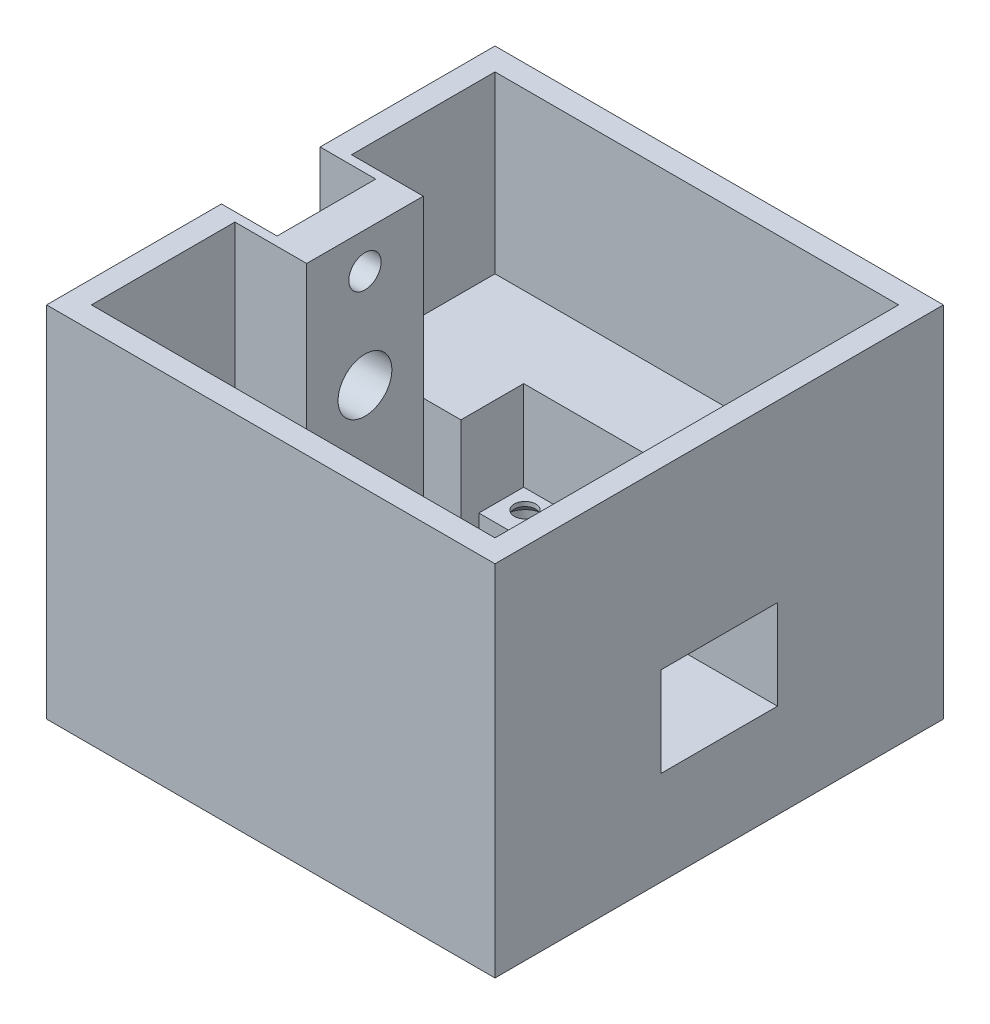
from build123d import *

# Parameters (mm, degrees)
SKETCH1_W                                      = 50
SKETCH1_H                                      = 50
BOSS_EXTRUDE1_DEPTH                            = 40
SHELL1_T                                       = -2.5
BOSS_EXTRUDE5_DEPTH                            = 18
SKETCH17_W                                     = 22.5
SKETCH17_H                                     = 6.5
BOSS_EXTRUDE6_DEPTH                            = 8
SKETCH18_W                                     = 6.5
SKETCH18_H                                     = 29.5
BOSS_EXTRUDE7_DEPTH                            = 8
SKETCH19_W                                     = 11
SKETCH19_H                                     = 30.2
CUT_EXTRUDE5_DEPTH                             = 6.2
SKETCH20_W                                     = 30.2
SKETCH20_H                                     = 5.4
CUT_EXTRUDE6_DEPTH                             = 6.2
SKETCH21_W                                     = 5
SKETCH21_H                                     = 5
BOSS_EXTRUDE8_DEPTH                            = 8
CSK_SLOT_FOR_M1_6_COUNTERSUNK_FLAT_H_2_COUNT   = 2
CSK_SLOT_FOR_M1_6_COUNTERSUNK_FLAT_H_2_PITCH   = 22
SKETCH28_R                                     = 3
CUT_EXTRUDE7_DEPTH                             = 47.046172479
CSK_SLOT_FOR_M1_6_COUNTERSUNK_FLAT_H_3_A_COUNT = 2
CSK_SLOT_FOR_M1_6_COUNTERSUNK_FLAT_H_3_A_PITCH = 22
SKETCH32_R                                     = 3
CUT_EXTRUDE8_DEPTH                             = 62.524385409
CUT_EXTRUDE10_REACH                            = 48.046
SKETCH34_W                                     = 6
SKETCH34_H                                     = 6.5
SKETCH35_W                                     = 5
SKETCH35_H                                     = 5
BOSS_EXTRUDE9_DEPTH                            = 8
CSK_SLOT_FOR_M2_COUNTERSUNK_FLAT_HEA_2_COUNT   = 2
CSK_SLOT_FOR_M2_COUNTERSUNK_FLAT_HEA_2_PITCH   = 29.99
CSK_SLOT_FOR_M2_COUNTERSUNK_FLAT_HEA_3_COUNT   = 2
CSK_SLOT_FOR_M2_COUNTERSUNK_FLAT_HEA_3_PITCH   = 16
CSK_SLOT_FOR_M2_COUNTERSUNK_FLAT_HEA_4_COUNT   = 2
CSK_SLOT_FOR_M2_COUNTERSUNK_FLAT_HEA_4_PITCH   = 33.991176796
SKETCH38_W                                     = 13
SKETCH38_H                                     = 10
CUT_EXTRUDE11_DEPTH                            = 10


with BuildPart() as part:
    # Sketch1 → Boss-Extrude1 (new body)
    with BuildSketch(Plane(origin=(0, 0, 0), x_dir=(1, 0, 0), z_dir=(0, 1, 0))):
        Rectangle(SKETCH1_W, SKETCH1_H)
    extrude(amount=BOSS_EXTRUDE1_DEPTH)

    # Shell1
    shell1_openings = [part.faces().sort_by_distance(p)[0] for p in [
        (0, 40, 0),
    ]]
    offset(amount=SHELL1_T, openings=shell1_openings, kind=Kind.INTERSECTION)

    # Sketch16 → Boss-Extrude5 (add)
    with BuildSketch(Plane(origin=(0, 2.5, 0), x_dir=(1, 0, 0), z_dir=(0, 1, 0))):
        Polygon((-10.3, 6.5), (-22.5, 6.5), (-22.5, 22.5), (-5.169122612, 22.5), (22.5, 22.5), (22.5, 6.5), (10.3, 6.5), (10.3, 13.5), (-5.169122612, 13.5), (-10.3, 13.5), align=None)
        Polygon((10.3, -13.6), (22.5, -13.6), (22.5, -22.5), (-4.979068663, -22.5), (-22.5, -22.5), (-22.5, -13.6), (-10.3, -13.6), (-10.3, -20.79), (-4.979068663, -20.79), (10.3, -20.79), align=None)
    extrude(amount=BOSS_EXTRUDE5_DEPTH)

    # Sketch17 → Boss-Extrude6 (add)
    with BuildSketch(Plane(origin=(0, 2.5, 0), x_dir=(1, 0, 0), z_dir=(0, 1, 0))):
        Polygon((0, 0), (0, 6.5), (-10.3, 6.5), (-22.5, 6.5), (-22.5, 0), align=None)
        with Locations((-11.25, -3.25)):
            Rectangle(SKETCH17_W, SKETCH17_H)
        Polygon((10.3, 6.5), (0, 6.5), (0, 0), (0, -6.5), (22.5, -6.5), (22.5, 6.5), align=None)
    extrude(amount=BOSS_EXTRUDE6_DEPTH)

    # Sketch18 → Boss-Extrude7 (add)
    with BuildSketch(Plane(origin=(-22.5, 0, 0), x_dir=(0, 0, -1), z_dir=(1, 0, 0))):
        Polygon((6.5, 40), (0, 40), (0, 10.5), (6.5, 10.5), (6.5, 20.5), align=None)
        with Locations((-3.25, 25.25)):
            Rectangle(SKETCH18_W, SKETCH18_H)
    extrude(amount=BOSS_EXTRUDE7_DEPTH)

    # Sketch19 → Cut-Extrude5 (cut)
    with BuildSketch(Plane.ZY.offset(25)):
        with Locations((0, 24.9)):
            Rectangle(SKETCH19_W, SKETCH19_H)
    extrude(amount=-CUT_EXTRUDE5_DEPTH, mode=Mode.SUBTRACT)

    # Sketch20 → Cut-Extrude6 (cut)
    with BuildSketch(Plane.XZ):
        with Locations((0, 2.7)):
            Rectangle(SKETCH20_W, SKETCH20_H)
        with Locations((0, -2.7)):
            Rectangle(SKETCH20_W, SKETCH20_H)
    extrude(amount=-CUT_EXTRUDE6_DEPTH, mode=Mode.SUBTRACT)

    # Sketch21 → Boss-Extrude8 (add)
    with BuildSketch(Plane(origin=(0, 2.5, 0), x_dir=(1, 0, 0), z_dir=(0, 1, 0))):
        with Locations((7.8, -18.29)):
            Rectangle(SKETCH21_W, SKETCH21_H)
        with Locations((-7.8, -18.29)):
            Rectangle(SKETCH21_W, SKETCH21_H)
    extrude(amount=BOSS_EXTRUDE8_DEPTH)

    # Sketch26 → CSK SLOT for M1.6 Countersunk Flat Head (revolve, cut)
    with BuildSketch(Plane(origin=(-11, 10.5, 0), x_dir=(0, 0, 1), z_dir=(1, 0, 0))):
        Polygon((0, 0), (0, 10.5), (0.9, 10.5), (0.9, 3.9), (1.8, 3), (1.8, 0), align=None)
    csk_slot_for_m1_6_countersunk_flat_head = revolve(axis=Axis((-11, 16.85, 0), (0, -1, 0)), mode=Mode.SUBTRACT)

    # CSK SLOT for M1.6 Countersunk Flat H 2: CSK SLOT for M1.6 Countersunk Flat Head ×2
    with Locations(*[(i * CSK_SLOT_FOR_M1_6_COUNTERSUNK_FLAT_H_2_PITCH, 0, 0) for i in range(1, CSK_SLOT_FOR_M1_6_COUNTERSUNK_FLAT_H_2_COUNT)]):
        add(csk_slot_for_m1_6_countersunk_flat_head, mode=Mode.SUBTRACT)

    # Sketch28 → Cut-Extrude7 (cut, through all)
    with BuildSketch(Plane(origin=(0, 10.5, 0), x_dir=(1, 0, 0), z_dir=(0, 1, 0))):
        with Locations(Location((0, 0, 0), (0, 0, 270))):
            Circle(SKETCH28_R)
    extrude(amount=-CUT_EXTRUDE7_DEPTH, mode=Mode.SUBTRACT)

    # Sketch31 → CSK SLOT for M1.6 Countersunk Flat H 3 (revolve, cut)
    with BuildSketch(Plane(origin=(-14.5, 36, 0), x_dir=(0, 0, -1), z_dir=(0, 1, 0))):
        Polygon((0, 0), (0, 10.5), (0.9, 10.5), (0.9, 3.9), (1.8, 3), (1.8, 0), align=None)
    csk_slot_for_m1_6_countersunk_flat_h_3 = revolve(axis=Axis((-8.15, 36, 0), (-1, 0, 0)), mode=Mode.SUBTRACT)

    # CSK SLOT for M1.6 Countersunk Flat H 3 a: CSK SLOT for M1.6 Countersunk Flat H 3 ×2
    with Locations(*[(0, -i * CSK_SLOT_FOR_M1_6_COUNTERSUNK_FLAT_H_3_A_PITCH, 0) for i in range(1, CSK_SLOT_FOR_M1_6_COUNTERSUNK_FLAT_H_3_A_COUNT)]):
        add(csk_slot_for_m1_6_countersunk_flat_h_3, mode=Mode.SUBTRACT)

    # Sketch32 → Cut-Extrude8 (cut, through all)
    with BuildSketch(Plane(origin=(-14.5, 0, 0), x_dir=(0, 0, -1), z_dir=(1, 0, 0))):
        with Locations((0, 25)):
            Circle(SKETCH32_R)
    extrude(amount=-CUT_EXTRUDE8_DEPTH, mode=Mode.SUBTRACT)

    # Cut-Extrude10: up to this face of the body (flat: up to its plane)
    cut_extrude10_end = Plane(part.part.faces().sort_by_distance((0, 2.5, 11.597540384))[0])
    # Sketch34 → Cut-Extrude10 (cut, up to the picked face)
    with BuildSketch(Plane(origin=(0, 10.5, 0), x_dir=(1, 0, 0), z_dir=(0, 1, 0)), mode=Mode.PRIVATE) as cut_extrude10_sk1:
        with Locations((0, -3.25)):
            Rectangle(SKETCH34_W, SKETCH34_H)
    cut_extrude10_tool1 = split(extrude(cut_extrude10_sk1.sketch, amount=-CUT_EXTRUDE10_REACH, mode=Mode.PRIVATE), bisect_by=cut_extrude10_end, keep=Keep.BOTH, mode=Mode.PRIVATE)
    add(cut_extrude10_tool1.solids().sort_by(Axis((0, 10.5, 3.25), (0, -1, 0)))[0], mode=Mode.SUBTRACT)

    # Sketch35 → Boss-Extrude9 (add)
    with BuildSketch(Plane(origin=(0, 2.5, 0), x_dir=(1, 0, 0), z_dir=(0, 1, 0))):
        with Locations((-7.8, 11)):
            Rectangle(SKETCH35_W, SKETCH35_H)
        with Locations((7.8, 11)):
            Rectangle(SKETCH35_W, SKETCH35_H)
    extrude(amount=BOSS_EXTRUDE9_DEPTH)

    # Sketch37 → CSK SLOT for M2 Countersunk Flat Head Screw1 (revolve, cut)
    with BuildSketch(Plane(origin=(8, 0, 18.64), x_dir=(0, 0, -1), z_dir=(1, 0, 0))):
        Polygon((0, 0), (0, 40), (1.2, 40), (1.2, 10), (2.2, 9), (2.2, 0), align=None)
    csk_slot_for_m2_countersunk_flat_head_sc = revolve(axis=Axis((8, -6.35, 18.64), (0, 1, 0)), mode=Mode.SUBTRACT)

    # CSK SLOT for M2 Countersunk Flat Hea 2: CSK SLOT for M2 Countersunk Flat Head Screw1 ×2
    with Locations(*[(0, 0, -i * CSK_SLOT_FOR_M2_COUNTERSUNK_FLAT_HEA_2_PITCH) for i in range(1, CSK_SLOT_FOR_M2_COUNTERSUNK_FLAT_HEA_2_COUNT)]):
        add(csk_slot_for_m2_countersunk_flat_head_sc, mode=Mode.SUBTRACT)

    # CSK SLOT for M2 Countersunk Flat Hea 3: CSK SLOT for M2 Countersunk Flat Head Screw1 ×2
    with Locations(*[(-i * CSK_SLOT_FOR_M2_COUNTERSUNK_FLAT_HEA_3_PITCH, 0, 0) for i in range(1, CSK_SLOT_FOR_M2_COUNTERSUNK_FLAT_HEA_3_COUNT)]):
        add(csk_slot_for_m2_countersunk_flat_head_sc, mode=Mode.SUBTRACT)

    # CSK SLOT for M2 Countersunk Flat Hea 4: CSK SLOT for M2 Countersunk Flat Head Screw1 ×2
    with Locations(*[Vector(-0.47071038745922766, 0, -0.882287782493889) * (i * CSK_SLOT_FOR_M2_COUNTERSUNK_FLAT_HEA_4_PITCH) for i in range(1, CSK_SLOT_FOR_M2_COUNTERSUNK_FLAT_HEA_4_COUNT)]):
        add(csk_slot_for_m2_countersunk_flat_head_sc, mode=Mode.SUBTRACT)

    # Sketch38 → Cut-Extrude11 (cut)
    with BuildSketch(Plane.ZY.offset(-22.5)):
        with Locations((0, 15.5)):
            Rectangle(SKETCH38_W, SKETCH38_H)
    extrude(amount=-CUT_EXTRUDE11_DEPTH, mode=Mode.SUBTRACT)


solid = part.part
